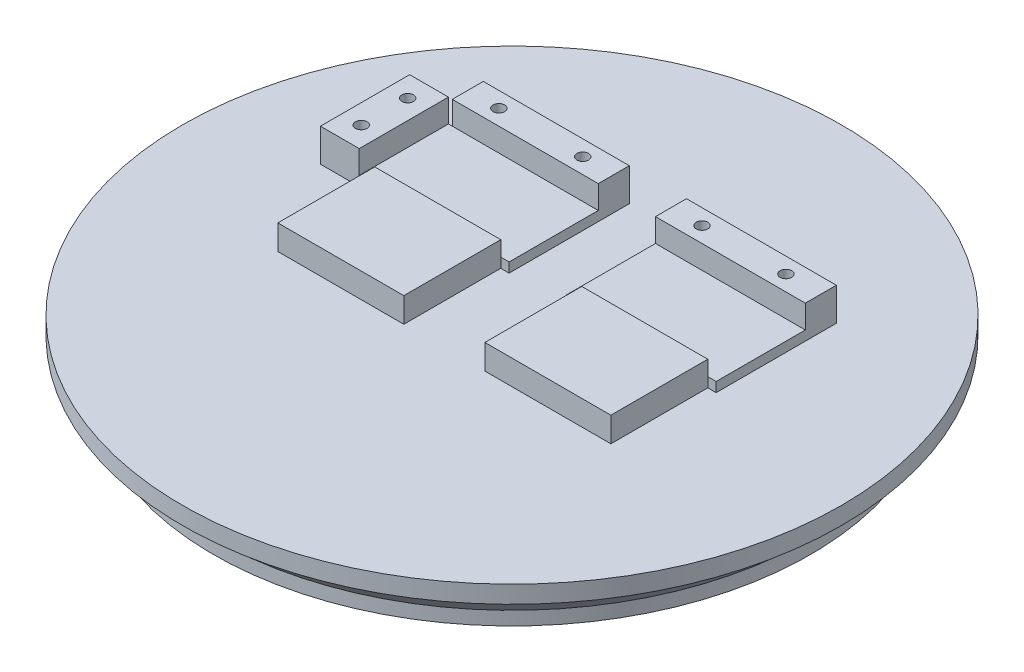
from build123d import *

# Parameters (mm, degrees)
SKETCH2_R           = 71
BOSS_EXTRUDE1_DEPTH = 11
SKETCH10_W          = 37.65
SKETCH10_H          = 8
SKETCH10_R          = 1.5
SKETCH10_W_2        = 10
SKETCH10_H_2        = 23
SKETCH10_W_3        = 1
BOSS_EXTRUDE6_DEPTH = 8.5
SKETCH12_R          = 57.5
SKETCH12_R_2        = 23.75
CUT_EXTRUDE8_DEPTH  = 1
SKETCH11_W          = 38.65
SKETCH11_H          = 23
BOSS_EXTRUDE7_DEPTH = 2.5
SKETCH14_W          = 32.5
SKETCH14_H          = 25
BOSS_EXTRUDE8_DEPTH = 6.4


with BuildPart() as part:
    # Sketch1 → Revolve1 (revolve)
    with BuildSketch(Plane.XY, mode=Mode.PRIVATE) as revolve1_sk:
        Polygon((0, 12), (0, 15), (85, 15), (85, 10.5), (84, 10.5), (77, 3.5), (77, 0), (71, 0), (71, 12), (23.75, 12), (23.75, -7.5), (21.25, -7.5), (21.25, 6), (6.5, 6), (6.5, 9), (0, 9), align=None)
    revolve(revolve1_sk.sketch.rotate(Axis((0, 12, 0), (0, -1, 0)), 180), axis=Axis((0, 12, 0), (0, -1, 0)))

    # Sketch2 → Boss-Extrude1 (add)
    with BuildSketch(Plane.XZ.offset(-12)):
        with Locations(Location((0, 0, 0), (0, 0, 180))):
            Circle(SKETCH2_R)
        Polygon((0, 70.292395274), (-60.875, 35.146197637), (-60.875, -35.146197637), (0, -70.292395274), (60.875, -35.146197637), (60.875, 35.146197637), align=None, mode=Mode.SUBTRACT)
    extrude(amount=BOSS_EXTRUDE1_DEPTH)

    # Sketch10 → Boss-Extrude6 (add)
    # profile 1 of 4: a face of its own
    with BuildSketch(Plane(origin=(0, 15, 0), x_dir=(1, 0, 0), z_dir=(0, 1, 0))):
        with Locations((-28.575, 36)):
            Rectangle(SKETCH10_W, SKETCH10_H)
        with Locations(Location((-39.4, 36, 0), (0, 0, 180))):
            Circle(SKETCH10_R, mode=Mode.SUBTRACT)
        with Locations(Location((-17.75, 36, 0), (0, 0, 180))):
            Circle(SKETCH10_R, mode=Mode.SUBTRACT)
    # profile 2 of 4: a face of its own
    with BuildSketch(Plane(origin=(0, 15, 0), x_dir=(1, 0, 0), z_dir=(0, 1, 0))):
        with Locations((-53.4, 20.5)):
            Rectangle(SKETCH10_W_2, SKETCH10_H_2)
        with Locations(Location((-53.4, 14.5, 0), (0, 0, 180))):
            Circle(SKETCH10_R, mode=Mode.SUBTRACT)
        with Locations(Location((-53.4, 26.5, 0), (0, 0, 180))):
            Circle(SKETCH10_R, mode=Mode.SUBTRACT)
    # profile 3 of 4: a face of its own
    with BuildSketch(Plane(origin=(0, 15, 0), x_dir=(1, 0, 0), z_dir=(0, 1, 0))):
        with Locations((23.825, 36)):
            Rectangle(SKETCH10_W, SKETCH10_H)
        with Locations(Location((13, 36, 0), (0, 0, 180))):
            Circle(SKETCH10_R, mode=Mode.SUBTRACT)
        with Locations(Location((34.65, 36, 0), (0, 0, 180))):
            Circle(SKETCH10_R, mode=Mode.SUBTRACT)
    # profile 4 of 4: a face of its own
    with BuildSketch(Plane(origin=(0, 15, 0), x_dir=(1, 0, 0), z_dir=(0, 1, 0))):
        with Locations((43.15, 36)):
            Rectangle(SKETCH10_W_3, SKETCH10_H)
    extrude(amount=BOSS_EXTRUDE6_DEPTH)

    # Sketch12 → Cut-Extrude8 (cut)
    with BuildSketch(Plane.XZ.offset(-12)):
        Circle(SKETCH12_R)
        with Locations(Location((0, 0, 0), (0, 0, 180))):
            Circle(SKETCH12_R_2, mode=Mode.SUBTRACT)
    extrude(amount=-CUT_EXTRUDE8_DEPTH, mode=Mode.SUBTRACT)

    # Sketch11 → Boss-Extrude7 (add)
    with BuildSketch(Plane(origin=(0, 15, 0), x_dir=(1, 0, 0), z_dir=(0, 1, 0))):
        with Locations((-29.075, 20.5)):
            Rectangle(SKETCH11_W, SKETCH11_H)
        with Locations((24.325, 20.5)):
            Rectangle(SKETCH11_W, SKETCH11_H)
    extrude(amount=BOSS_EXTRUDE7_DEPTH)

    # Sketch14 → Boss-Extrude8 (add)
    with BuildSketch(Plane(origin=(0, 15, 0), x_dir=(1, 0, 0), z_dir=(0, 1, 0))):
        with Locations((-28.15, -3.5)):
            Rectangle(SKETCH14_W, SKETCH14_H)
        with Locations((25.25, -3.5)):
            Rectangle(SKETCH14_W, SKETCH14_H)
    extrude(amount=BOSS_EXTRUDE8_DEPTH)


solid = part.part
